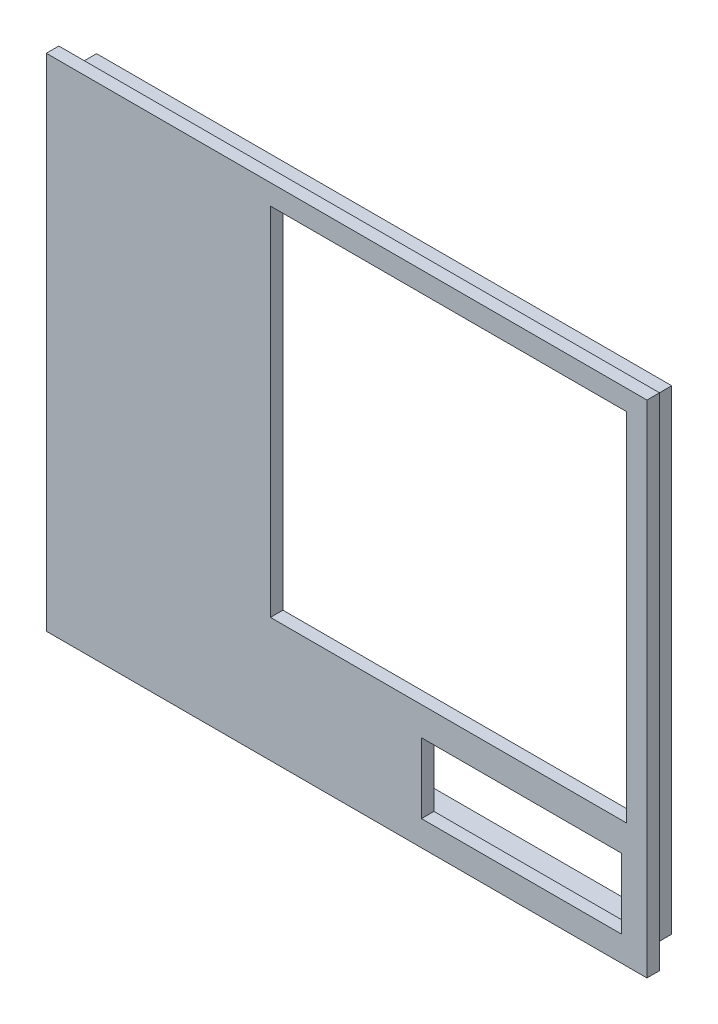
from build123d import *

# Parameters (mm, degrees)
SKETCH2_W           = 120
SKETCH2_H           = 100
BOSS_EXTRUDE1_DEPTH = 2.5
SKETCH3_W           = 114.9
SKETCH3_H           = 94.9
SKETCH3_W_2         = 111.9
SKETCH3_H_2         = 91.9
BOSS_EXTRUDE2_DEPTH = 5
SKETCH4_W           = 71.17
SKETCH4_H           = 71.17
SKETCH4_W_2         = 40
SKETCH4_H_2         = 14
CUT_EXTRUDE1_DEPTH  = 2.5


with BuildPart() as part:
    # Sketch2 → Boss-Extrude1 (new body)
    with BuildSketch(Plane.XY):
        Rectangle(SKETCH2_W, SKETCH2_H)
    extrude(amount=BOSS_EXTRUDE1_DEPTH)

    # Sketch3 → Boss-Extrude2 (add)
    with BuildSketch(Plane(origin=(0, 0, 0), x_dir=(-1, 0, 0), z_dir=(0, 0, -1))):
        Rectangle(SKETCH3_W, SKETCH3_H)
        Rectangle(SKETCH3_W_2, SKETCH3_H_2, mode=Mode.SUBTRACT)
    extrude(amount=BOSS_EXTRUDE2_DEPTH)

    # Sketch4 → Cut-Extrude1 (cut)
    with BuildSketch(Plane(origin=(0, 0, 0), x_dir=(-1, 0, 0), z_dir=(0, 0, -1))):
        with Locations((-20.365, 10.365)):
            Rectangle(SKETCH4_W, SKETCH4_H)
        with Locations((-34.95, -37.95)):
            Rectangle(SKETCH4_W_2, SKETCH4_H_2)
    extrude(amount=-CUT_EXTRUDE1_DEPTH, mode=Mode.SUBTRACT)


solid = part.part
